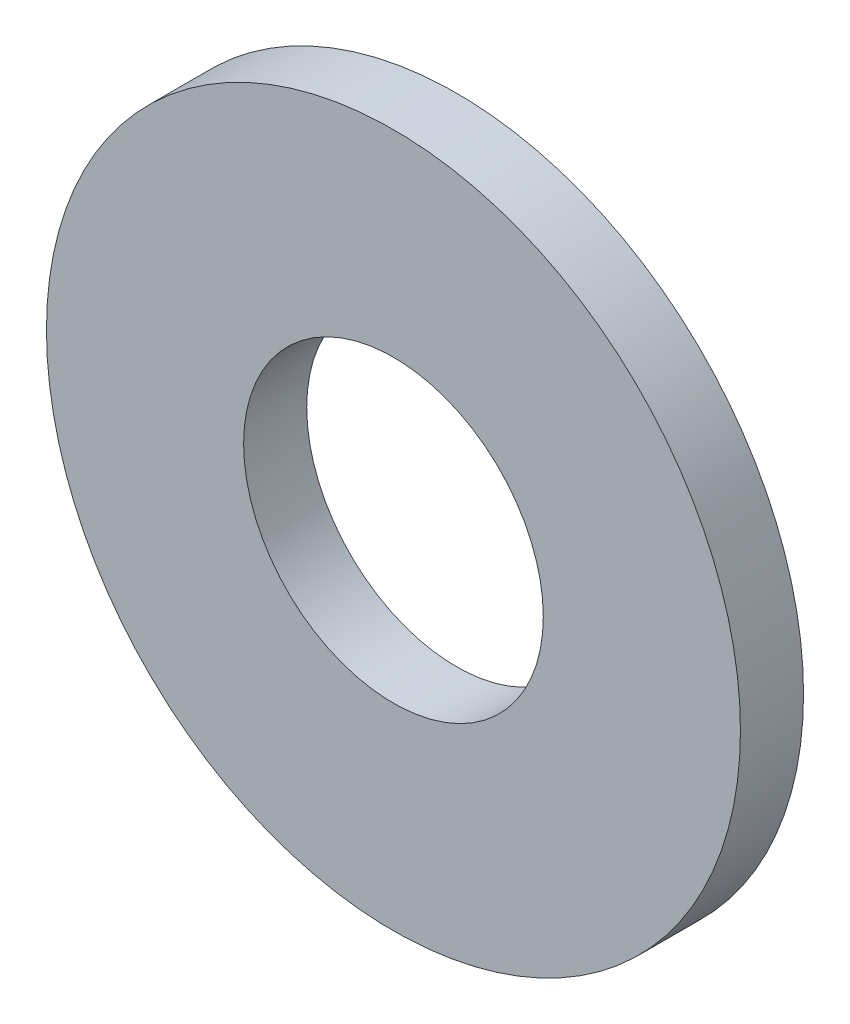
from build123d import *

# Parameters (mm, degrees)
BOSS_EXTRUDE1_DEPTH      = 0.508
BOSS_EXTRUDE1_DEPTH_BACK = 0.508
SKETCH3_R                = 5.588
SKETCH3_R_2              = 2.413


with BuildPart() as part:
    # Sketch3 → Boss-Extrude1 (new, two sides: drawn at the far end of the back side and taken through both)
    with BuildSketch(Plane.XY.offset(-BOSS_EXTRUDE1_DEPTH_BACK)):
        Circle(SKETCH3_R)
        Circle(SKETCH3_R_2, mode=Mode.SUBTRACT)
    extrude(amount=BOSS_EXTRUDE1_DEPTH + BOSS_EXTRUDE1_DEPTH_BACK)


solid = part.part
